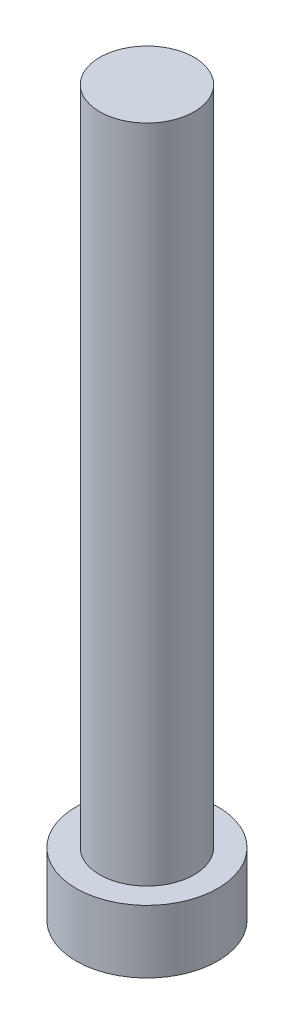
from build123d import *

# Parameters (mm, degrees)
SKETCH1_R           = 15
BOSS_EXTRUDE1_DEPTH = 230
SKETCH1_4_R         = 22.5
SKETCH1_4_R_2       = 15
BOSS_EXTRUDE2_DEPTH = 20


with BuildPart() as part:
    # Sketch1 → Boss-Extrude1 (new body)
    with BuildSketch(Plane(origin=(0, 0, 0), x_dir=(1, 0, 0), z_dir=(0, 1, 0))):
        Circle(SKETCH1_R)
    extrude(amount=BOSS_EXTRUDE1_DEPTH)

    # Sketch1<4> → Boss-Extrude2 (add)
    with BuildSketch(Plane(origin=(0, 0, 0), x_dir=(1, 0, 0), z_dir=(0, 1, 0))):
        Circle(SKETCH1_4_R)
        Circle(SKETCH1_4_R_2, mode=Mode.SUBTRACT)
    extrude(amount=BOSS_EXTRUDE2_DEPTH)


solid = part.part
